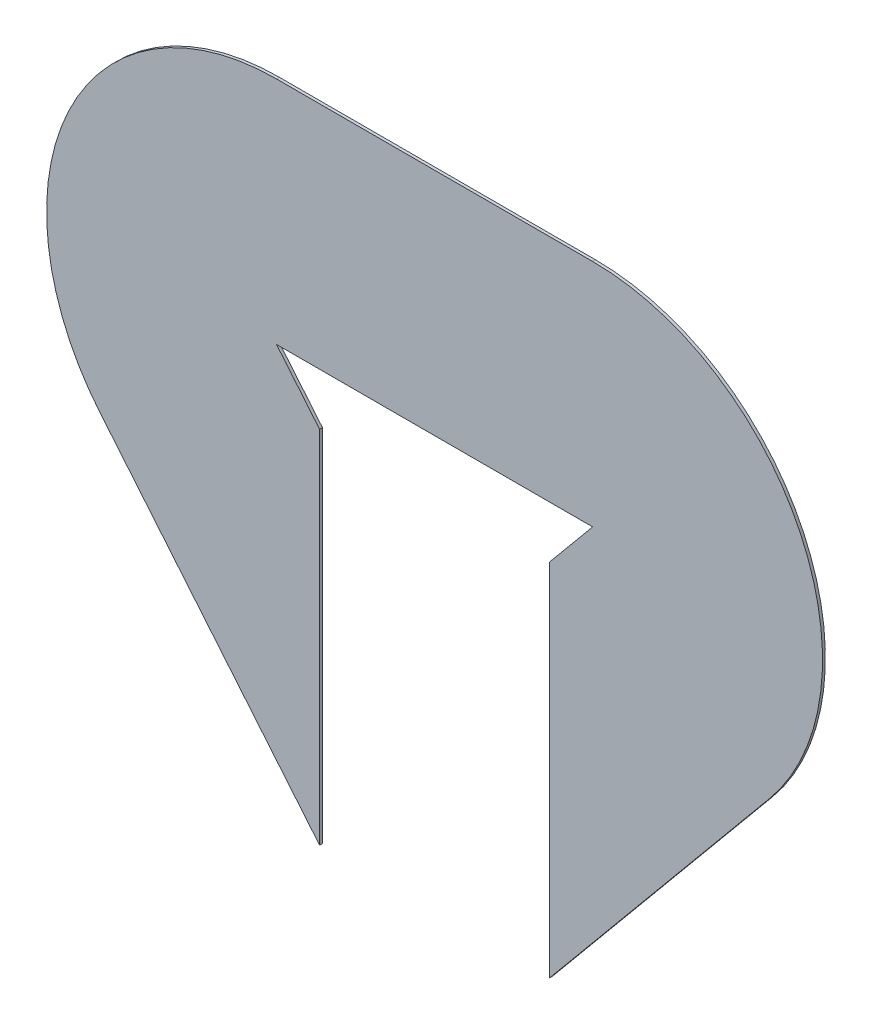
from build123d import *

# Parameters (mm, degrees)
BOSS_EXTRUDE2_DEPTH = 2.54


with BuildPart() as part:
    # Sketch1 → Boss-Extrude2 (new body)
    with BuildSketch(Plane.XY):
        with BuildLine():
            Line((280.770009641, 169.165015451), (242.670009641, 123.208075057))
            Line((242.670009641, 123.208075057), (242.670009641, -195.172287059))
            Line((242.670009641, -195.172287059), (437.202610799, 39.476614679))
            ThreePointArc((437.202610799, 39.476614679), (464.676131123, 255.58711032), (280.770009641, 372.365015451))
            Line((280.770009641, 372.365015451), (1.370009641, 372.365015451))
            ThreePointArc((1.370009641, 372.365015451), (-182.536111841, 255.58711032), (-155.062591517, 39.476614679))
            Line((-155.062591517, 39.476614679), (39.470009641, -195.172287059))
            Line((39.470009641, -195.172287059), (39.470009641, 123.208075057))
            Line((39.470009641, 123.208075057), (1.370009641, 169.165015451))
            Line((1.370009641, 169.165015451), (39.470009641, 169.165015451))
            Line((39.470009641, 169.165015451), (242.670009641, 169.165015451))
            Line((242.670009641, 169.165015451), (280.770009641, 169.165015451))
        make_face()
    extrude(amount=BOSS_EXTRUDE2_DEPTH)


solid = part.part
